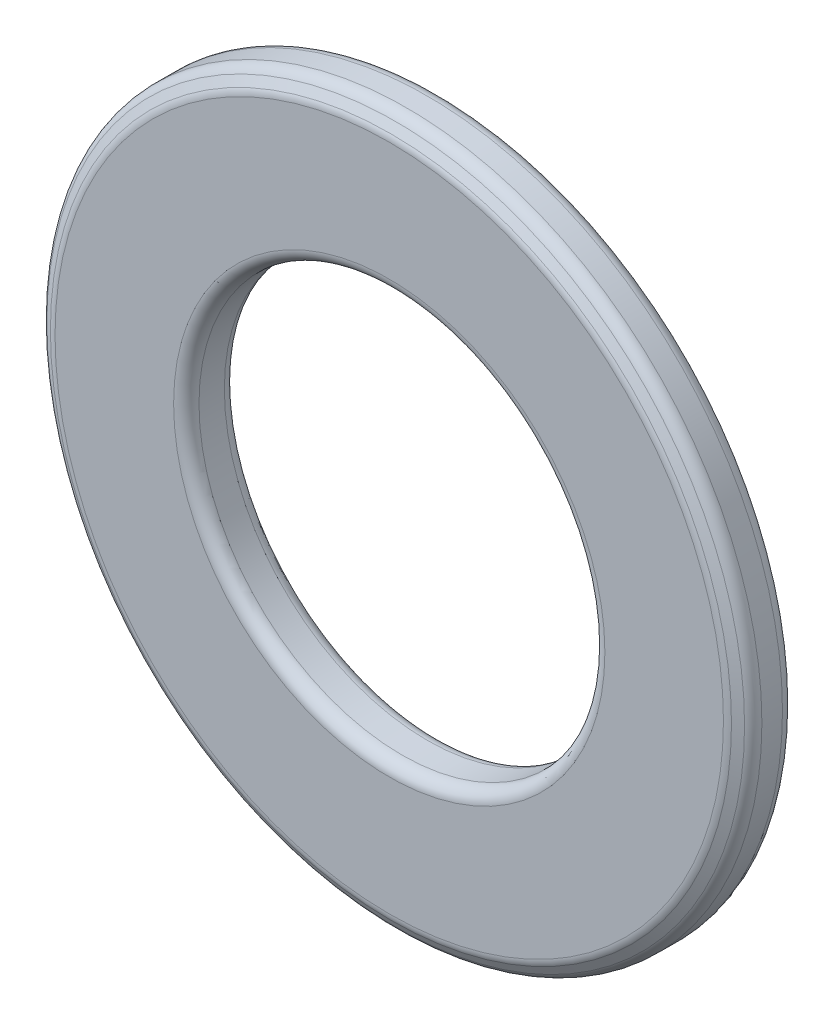
from build123d import *

# Parameters (mm, degrees)
SKETCH1_R           = 7
SKETCH1_R_2         = 4
BOSS_EXTRUDE1_DEPTH = 1
CHAMFER1_SIZE       = 0.2
CHAMFER1_SIZE2      = 0.346410162
FILLET1_R           = 0.25


with BuildPart() as part:
    # Sketch1 → Boss-Extrude1 (new body)
    with BuildSketch(Plane.XY):
        with Locations((15.2300359, -44.782538686)):
            Circle(SKETCH1_R)
        with Locations((15.2300359, -44.782538686)):
            Circle(SKETCH1_R_2, mode=Mode.SUBTRACT)
    extrude(amount=BOSS_EXTRUDE1_DEPTH)

    # Chamfer1
    chamfer1_edges = [part.edges().sort_by_distance(p)[0] for p in [
        (8.2300359, -44.782538686, 1),
    ]]
    chamfer1_side = [part.faces().sort_by_distance(p)[0] for p in [
        (8.2300359, -44.782538686, 0.5),
    ]]
    chamfer(chamfer1_edges, length=CHAMFER1_SIZE, length2=CHAMFER1_SIZE2, reference=chamfer1_side[0])

    # Fillet1
    fillet1_edges = [part.edges().sort_by_distance(p)[0] for p in [
        (8.2300359, -44.782538686, 0.8),
        (8.2300359, -44.782538686, 0),
        (11.2300359, -44.782538686, 0),
        (11.2300359, -44.782538686, 1),
        (8.576446062, -44.782538686, 1),
    ]]
    fillet(fillet1_edges, radius=FILLET1_R)


solid = part.part
